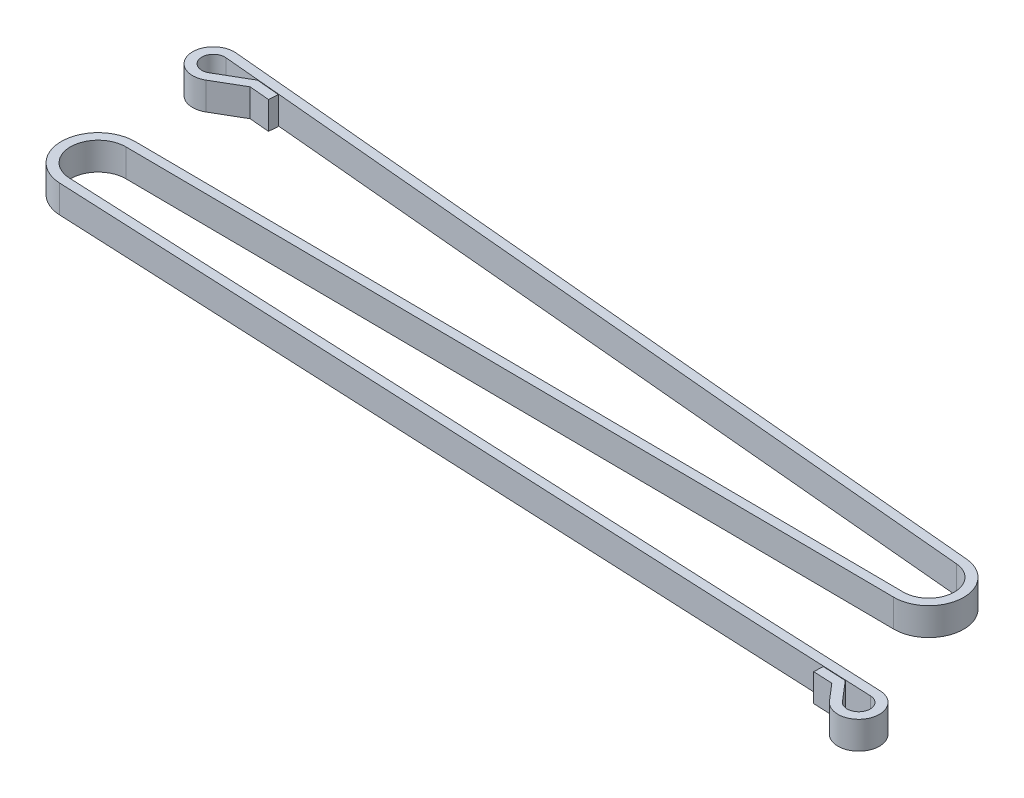
from build123d import *

# Parameters (mm, degrees)
EXTRUDE_THIN1_DEPTH = 3


with BuildPart() as part:
    # Sketch2 → Extrude-Thin1 (new, symmetric)
    with BuildSketch(Plane(origin=(0, 19.326776695, 0), x_dir=(1, 0, 0), z_dir=(0, 1, 0))):
        with BuildLine():
            Line((83.328079119, -22.116037785), (88.322896843, -22.343624921))
            Line((88.322896843, -22.343624921), (91.997250324, -26.627587507))
            ThreePointArc((91.997250324, -26.627587507), (96.141958225, -26.095715612), (94.008663166, -22.502591138))
            Line((94.008663166, -22.502591138), (-90.364139419, -14.101708358))
            ThreePointArc((-90.364139419, -14.101708358), (-97.997143033, -5.896216694), (-89.936648421, 1.889749157))
            Line((-89.936648421, 1.889749157), (77.956049842, 0.560174022))
            ThreePointArc((77.956049842, 0.560174022), (83.543259885, 5.836559245), (78.502463441, 11.6372082))
            Line((78.502463441, 11.6372082), (-95.878795519, 27.489733424))
            ThreePointArc((-95.878795519, 27.489733424), (-98.545913109, 24.45909356), (-94.848135548, 22.838990066))
            Line((-94.848135548, 22.838990066), (-88.221929105, 26.693256199))
            Line((-88.221929105, 26.693256199), (-83.242462258, 26.240586433))
            Line((-83.242462258, 26.240586433), (-83.423530164, 24.248799694))
            Line((-83.423530164, 24.248799694), (-87.767727276, 24.643718819))
            Line((-87.767727276, 24.643718819), (-93.842539664, 21.110182118))
            ThreePointArc((-93.842539664, 21.110182118), (-100.498539275, 24.026368407), (-95.697727612, 29.481520162))
            Line((-95.697727612, 29.481520162), (78.683531348, 13.628994939))
            ThreePointArc((78.683531348, 13.628994939), (85.540831015, 5.738022037), (77.940211947, -1.439763267))
            Line((77.940211947, -1.439763267), (-89.952486316, -0.110188132))
            ThreePointArc((-89.952486316, -0.110188132), (-95.997857275, -5.949662521), (-90.273104564, -12.103781269))
            Line((-90.273104564, -12.103781269), (94.099698021, -20.504664048))
            ThreePointArc((94.099698021, -20.504664048), (97.939629126, -26.972288102), (90.479154905, -27.929657512))
            Line((90.479154905, -27.929657512), (87.367872452, -24.302184627))
            Line((87.367872452, -24.302184627), (83.237044264, -24.113964874))
            Line((83.237044264, -24.113964874), (83.328079119, -22.116037785))
        make_face()
    extrude(amount=EXTRUDE_THIN1_DEPTH, both=True)


solid = part.part
